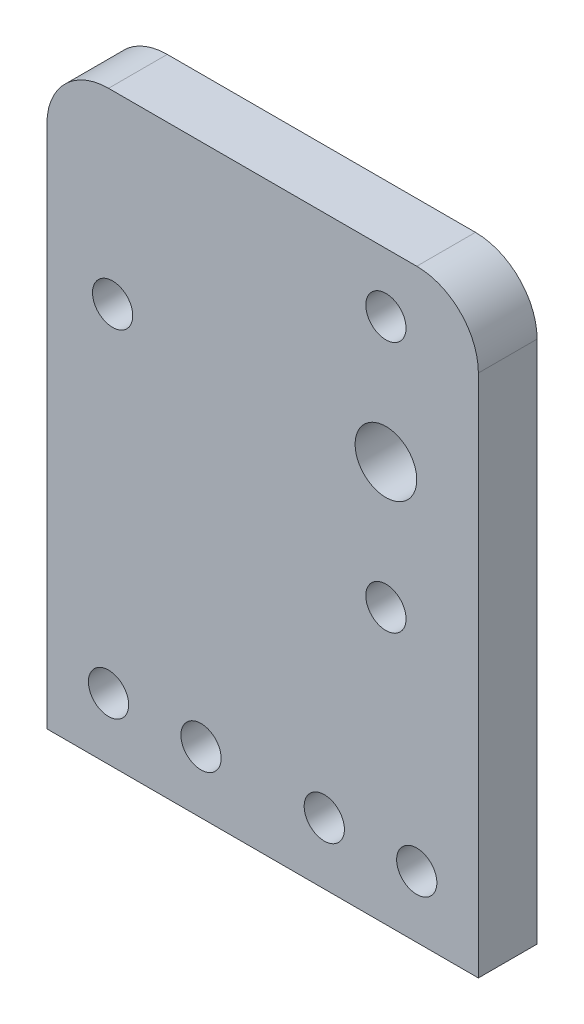
from build123d import *

# Parameters (mm, degrees)
SKETCH1_W             = 35
SKETCH1_H             = 47.5
SKETCH1_R             = 2.5
BOSS_EXTRUDE1_DEPTH   = 4.7625
F_4_CLEARANCE_HOLE1_D = 3.2639
FILLET1_R             = 5
F_4_CLEARANCE_HOLE2_D = 3.2639


with BuildPart() as part:
    # Sketch1 → Boss-Extrude1 (new body)
    with BuildSketch(Plane.XY):
        Rectangle(SKETCH1_W, SKETCH1_H)
        with Locations(Location((10, 8.75, 0), (0, 0, 180))):
            Circle(SKETCH1_R, mode=Mode.SUBTRACT)
    extrude(amount=BOSS_EXTRUDE1_DEPTH)

    # #4 Clearance Hole1 (through all)
    with Locations(Plane.XY.offset(4.7625)):
        with Locations((10, 18.96), (10, -1.46), (-12.17, 8.75)):
            Hole(F_4_CLEARANCE_HOLE1_D / 2)

    # Fillet1
    fillet1_edges = [part.edges().sort_by_distance(p)[0] for p in [
        (-17.5, 23.75, 2.38125),
        (17.5, 23.75, 2.38125),
    ]]
    fillet(fillet1_edges, radius=FILLET1_R)

    # #4 Clearance Hole2 (through all)
    with Locations(Plane.XY.offset(4.7625)):
        with Locations((-12.5, -18.75), (12.5, -18.75), (-5, -18.75), (5, -18.75)):
            Hole(F_4_CLEARANCE_HOLE2_D / 2)


solid = part.part
